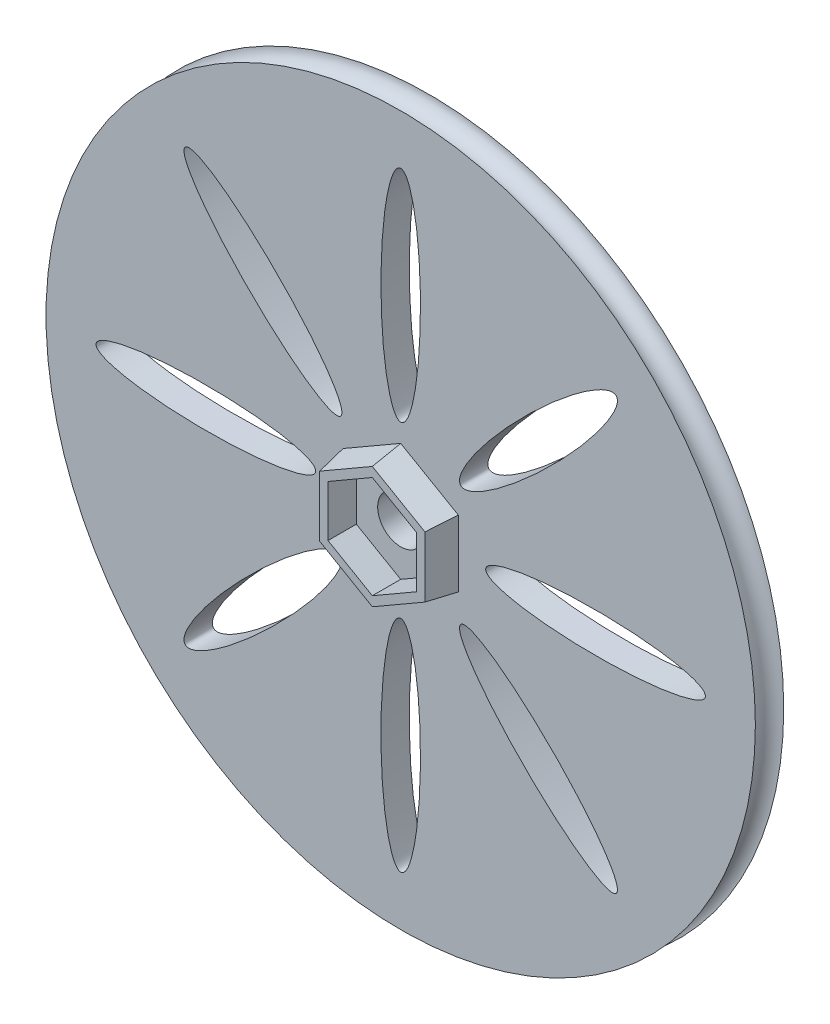
from build123d import *

# Parameters (mm, degrees)
SKETCH1_R           = 50.8
BOSS_EXTRUDE1_DEPTH = 2.032
BOSS_EXTRUDE2_DEPTH = 4.064
BOSS_EXTRUDE2_TAPER = 10
CUT_EXTRUDE3_DEPTH  = 4.064
CUT_EXTRUDE4_REACH  = 73.957
SKETCH7_R           = 3.302
SKETCH9_RX          = 15.736275276
SKETCH9_RY          = 2.836171806
CUT_EXTRUDE6_DEPTH  = 72.956904436


with BuildPart() as part:
    # Sketch1 → Boss-Extrude1 (new, symmetric)
    with BuildSketch(Plane.XY):
        Circle(SKETCH1_R)
    extrude(amount=BOSS_EXTRUDE1_DEPTH, both=True)

    # Sketch2 → Cut-Revolve1 (revolve, cut)
    with BuildSketch(Plane(origin=(0, 0, 0), x_dir=(0, 0, -1), z_dir=(1, 0, 0)), mode=Mode.PRIVATE) as cut_revolve1_sk:
        with BuildLine():
            Line((-2.032, 50.8), (2.032, 50.8))
            ThreePointArc((2.032, 50.8), (0, 48.768), (-2.032, 50.8))
        make_face()
    revolve(cut_revolve1_sk.sketch.rotate(Axis((0, 0, 17.773156623), (0, 0, -1)), 90), axis=Axis((0, 0, 17.773156623), (0, 0, -1)), mode=Mode.SUBTRACT)

    # Sketch5 → Boss-Extrude2 (add)
    with BuildSketch(Plane.XY.offset(2.032)):
        Polygon((-8.255, -4.766026472), (0, -9.532052944), (8.255, -4.766026472), (8.255, 4.766026472), (0, 9.532052944), (-8.255, 4.766026472), align=None)
    extrude(amount=BOSS_EXTRUDE2_DEPTH, taper=BOSS_EXTRUDE2_TAPER)

    # Sketch6 → Cut-Extrude3 (cut)
    with BuildSketch(Plane.XY.offset(6.096)):
        Polygon((0, -7.332348419), (6.35, -3.666174209), (6.35, 3.666174209), (0, 7.332348419), (-6.35, 3.666174209), (-6.35, -3.666174209), align=None)
    extrude(amount=-CUT_EXTRUDE3_DEPTH, mode=Mode.SUBTRACT)

    # Sketch7 → Cut-Extrude4 (cut, up to next)
    with BuildSketch(Plane.XY.offset(2.032), mode=Mode.PRIVATE) as cut_extrude4_sk1:
        Circle(SKETCH7_R)
    cut_extrude4_tool1 = extrude(cut_extrude4_sk1.sketch, amount=-CUT_EXTRUDE4_REACH, mode=Mode.PRIVATE) & part.part
    add(cut_extrude4_tool1.solids().sort_by_distance((0, 0, 2.032))[0], mode=Mode.SUBTRACT)

    # Sketch9 → Cut-Extrude6 (cut, through all)
    with BuildSketch(Plane.XY.offset(2.032)):
        with Locations(Location((0, 27.906481822), (0, 0, -90))):
            Ellipse(SKETCH9_RX, SKETCH9_RY)
        with Locations(Location((19.732862535, 19.732862535), (0, 0, -135))):
            Ellipse(SKETCH9_RX, SKETCH9_RY)
        with Locations(Location((27.906481822, 0), (0, 0, 180))):
            Ellipse(SKETCH9_RX, SKETCH9_RY)
        with Locations(Location((19.732862535, -19.732862535), (0, 0, -45))):
            Ellipse(SKETCH9_RX, SKETCH9_RY)
        with Locations(Location((0, -27.906481822), (0, 0, 90))):
            Ellipse(SKETCH9_RX, SKETCH9_RY)
        with Locations(Location((-19.732862535, -19.732862535), (0, 0, 45))):
            Ellipse(SKETCH9_RX, SKETCH9_RY)
        with Locations(Location((-27.906481822, 0), (0, 0, 0))):
            Ellipse(SKETCH9_RX, SKETCH9_RY)
        with Locations(Location((-19.732862535, 19.732862535), (0, 0, 135))):
            Ellipse(SKETCH9_RX, SKETCH9_RY)
    extrude(amount=-CUT_EXTRUDE6_DEPTH, mode=Mode.SUBTRACT)


solid = part.part
